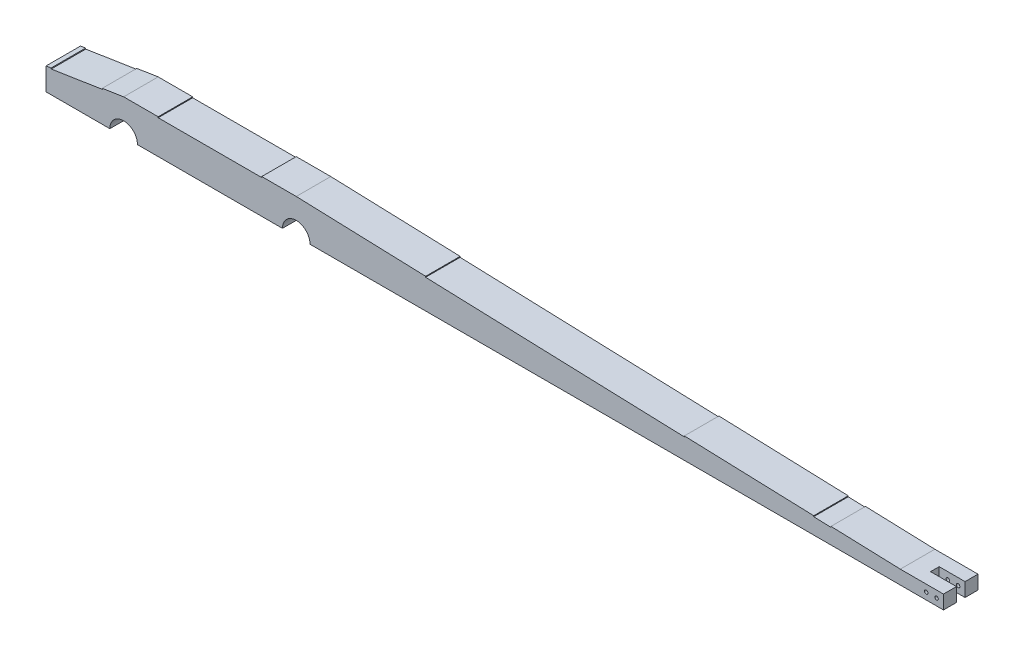
from build123d import *

# Parameters (mm, degrees)
BOSS_EXTRUDE1_DEPTH = 20
SKETCH2_W           = 150
SKETCH2_H           = 20
SKETCH2_W_2         = 10
ROPEGROOVE1_DEPTH   = 0.5
SKETCH4_W           = 60
SKETCH4_H           = 20
ROPEGROOVE2_DEPTH   = 0.5
SKETCH5_W           = 30
SKETCH5_H           = 20
ROPEGROOVE3_DEPTH   = 0.5
SKETCH6_W           = 15
SKETCH6_H           = 5
CUT_EXTRUDE1_DEPTH  = 376.724633209
CUT_EXTRUDE2_DEPTH  = 377.065153929


with BuildPart() as part:
    # Sketch1 → Boss-Extrude1 (new body)
    with BuildSketch(Plane.XY):
        with BuildLine():
            Line((-8, 0), (-92, 0))
            ThreePointArc((-92, 0), (-100, 8), (-108, 0))
            Line((-108, 0), (-145, 0))
            Line((-145, 0), (-145, 13))
            Line((-145, 13), (-100, 20))
            Line((-100, 20), (0, 20))
            Line((0, 20), (350, 8))
            Line((350, 8), (375, 8))
            Line((375, 8), (375, 0))
            Line((375, 0), (8, 0))
            ThreePointArc((8, 0), (0, 8), (-8, 0))
        make_face()
    extrude(amount=BOSS_EXTRUDE1_DEPTH)

    # Sketch2 → RopeGroove1 (cut)
    with BuildSketch(Plane(origin=(0.684909168, 19.9765174, 0), x_dir=(0.9994127625749618, -0.03426558043114153, 0), z_dir=(0.034265580431141536, 0.9994127625749619, 0))):
        with Locations((149.314688391, -10)):
            Rectangle(SKETCH2_W, SKETCH2_H)
        with Locations((304.314688391, -10)):
            Rectangle(SKETCH2_W_2, SKETCH2_H)
    extrude(amount=-ROPEGROOVE1_DEPTH, mode=Mode.SUBTRACT)

    # Sketch4 → RopeGroove2 (cut)
    with BuildSketch(Plane(origin=(0, 20, 0), x_dir=(1, 0, 0), z_dir=(0, 1, 0))):
        with Locations((-50, -10)):
            Rectangle(SKETCH4_W, SKETCH4_H)
    extrude(amount=-ROPEGROOVE2_DEPTH, mode=Mode.SUBTRACT)

    # Sketch5 → RopeGroove3 (cut)
    with BuildSketch(Plane(origin=(-5.400192864, 34.715525554, 0), x_dir=(0.9881164689548824, 0.15370700628187053, 0), z_dir=(-0.15370700628187053, 0.9881164689548824, 0))):
        with Locations((-123.278696917, -10)):
            Rectangle(SKETCH5_W, SKETCH5_H)
    extrude(amount=-ROPEGROOVE3_DEPTH, mode=Mode.SUBTRACT)

    # Sketch6 → Cut-Extrude1 (cut, through all)
    with BuildSketch(Plane(origin=(0, 8, 0), x_dir=(1, 0, 0), z_dir=(0, 1, 0))):
        with Locations((367.5, -10)):
            Rectangle(SKETCH6_W, SKETCH6_H)
    extrude(amount=-CUT_EXTRUDE1_DEPTH, mode=Mode.SUBTRACT)

    # Sketch7 → Cut-Extrude2 (cut, through all)
    with BuildSketch(Plane.XY.offset(20)):
        with BuildLine():
            ThreePointArc((364, 4), (365, 3), (366, 4))
            Line((366, 4), (364, 4))
        make_face()
        with BuildLine():
            Line((364, 4), (366, 4))
            ThreePointArc((366, 4), (365, 5), (364, 4))
        make_face()
        with BuildLine():
            ThreePointArc((370, 4), (371, 3), (372, 4))
            Line((372, 4), (370, 4))
        make_face()
        with BuildLine():
            Line((370, 4), (372, 4))
            ThreePointArc((372, 4), (371, 5), (370, 4))
        make_face()
    extrude(amount=-CUT_EXTRUDE2_DEPTH, mode=Mode.SUBTRACT)


solid = part.part
